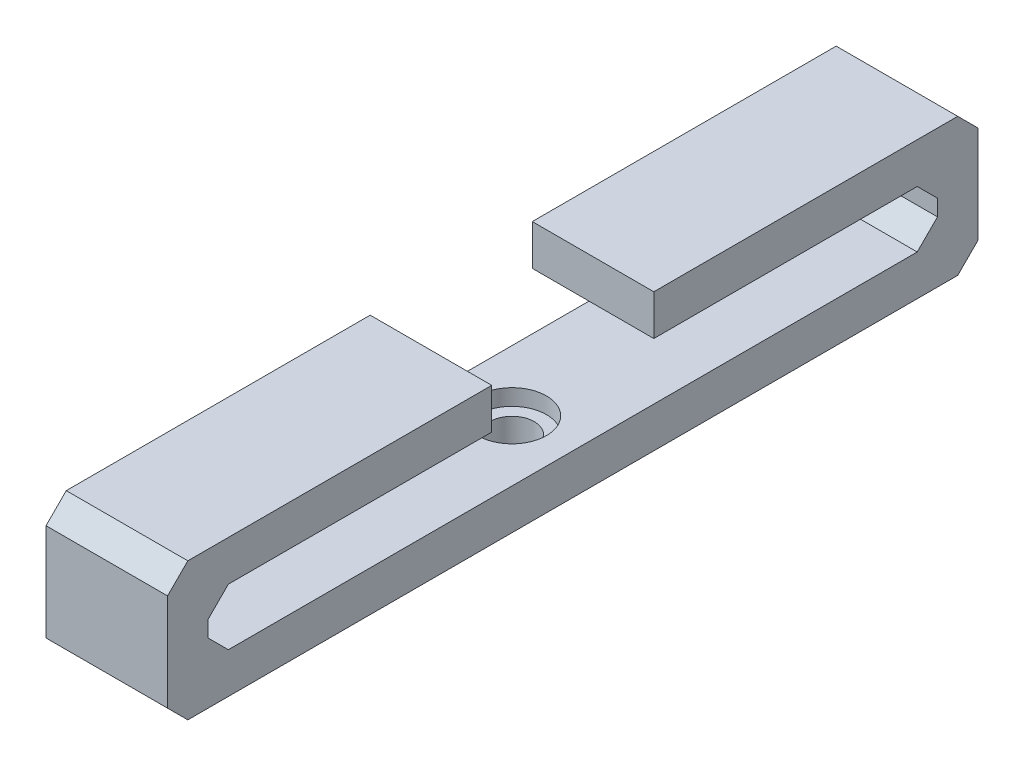
from build123d import *

# Parameters (mm, degrees)
BOSS_EXTRUDE1_DEPTH = 7.5
CHAMFER1_SIZE       = 2.5
SKETCH2_R           = 2.75
CUT_EXTRUDE1_DEPTH  = 52.963929798
SKETCH3_R           = 4.25
CUT_EXTRUDE2_DEPTH  = 2


with BuildPart() as part:
    # Sketch1 → Boss-Extrude1 (new, symmetric)
    with BuildSketch(Plane(origin=(0, 0, 0), x_dir=(0, 0, -1), z_dir=(1, 0, 0))):
        Polygon((10, 17), (10, 12), (45, 12), (45, 5), (-45, 5), (-45, 12), (-10, 12), (-10, 17), (-50, 17), (-50, 0), (50, 0), (50, 17), align=None)
    extrude(amount=BOSS_EXTRUDE1_DEPTH, both=True)

    # Chamfer1
    chamfer1_edges = [part.edges().sort_by_distance(p)[0] for p in [
        (0, 17, -50),
        (0, 0, -50),
        (0, 0, 50),
        (0, 17, 50),
        (0, 12, 45),
        (0, 5, 45),
        (0, 5, -45),
        (0, 12, -45),
    ]]
    chamfer(chamfer1_edges, length=CHAMFER1_SIZE)

    # Sketch2 → Cut-Extrude1 (cut, through all)
    with BuildSketch(Plane(origin=(0, 5, 0), x_dir=(1, 0, 0), z_dir=(0, 1, 0))):
        with Locations(Location((0, 0, 0), (0, 0, 270))):
            Circle(SKETCH2_R)
    extrude(amount=-CUT_EXTRUDE1_DEPTH, mode=Mode.SUBTRACT)

    # Sketch3 → Cut-Extrude2 (cut)
    with BuildSketch(Plane(origin=(0, 5, 0), x_dir=(1, 0, 0), z_dir=(0, 1, 0))):
        with Locations(Location((0, 0, 0), (0, 0, 270))):
            Circle(SKETCH3_R)
    extrude(amount=-CUT_EXTRUDE2_DEPTH, mode=Mode.SUBTRACT)


solid = part.part
